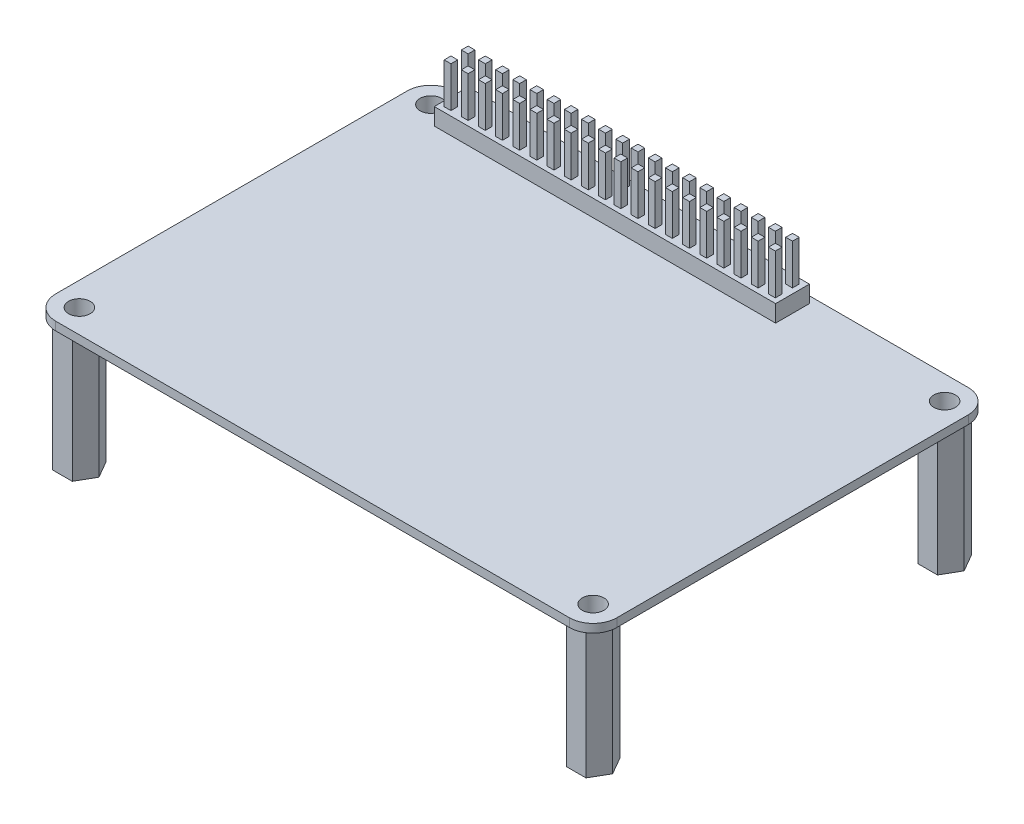
from build123d import *
from build123d.topology import SkipClean

# Parameters (mm, degrees)
ESQUISSE1_R        = 1.6
BOSS_EXTRU_1_DEPTH = 1.25
BOSS_EXTRU_2_START = 19.05
ESQUISSE2_R        = 1.6
BOSS_EXTRU_2_DEPTH = 19.05
ESQUISSE4_W        = 50.5
ESQUISSE4_H        = 5
BOSS_EXTRU_3_DEPTH = 2.5
ESQUISSE5_W        = 1
ESQUISSE5_H        = 1
BOSS_EXTRU_4_DEPTH = 6


with BuildPart() as part:
    # Esquisse1 → Boss.-Extru.1 (new body)
    with BuildSketch(Plane(origin=(0, 0, 0), x_dir=(1, 0, 0), z_dir=(0, 1, 0))):
        with BuildLine():
            Line((-38, -29.5), (38, -29.5))
            ThreePointArc((38, -29.5), (40.474873734, -28.474873734), (41.5, -26))
            Line((41.5, -26), (41.5, 26))
            ThreePointArc((41.5, 26), (40.474873734, 28.474873734), (38, 29.5))
            Line((38, 29.5), (-38, 29.5))
            ThreePointArc((-38, 29.5), (-40.474873734, 28.474873734), (-41.5, 26))
            Line((-41.5, 26), (-41.5, -26))
            ThreePointArc((-41.5, -26), (-40.474873734, -28.474873734), (-38, -29.5))
        make_face()
        with Locations(Location((38, 26, 0), (0, 0, 270))):
            Circle(ESQUISSE1_R, mode=Mode.SUBTRACT)
        with Locations(Location((38, -26, 0), (0, 0, 270))):
            Circle(ESQUISSE1_R, mode=Mode.SUBTRACT)
        with Locations(Location((-38, 26, 0), (0, 0, 270))):
            Circle(ESQUISSE1_R, mode=Mode.SUBTRACT)
        with Locations(Location((-38, -26, 0), (0, 0, 270))):
            Circle(ESQUISSE1_R, mode=Mode.SUBTRACT)
    extrude(amount=BOSS_EXTRU_1_DEPTH)

    # Esquisse2 → Boss.-Extru.2 (add)
    # profile 1 of 4: a face of its own
    with SkipClean():  # the faces are left unmerged after this step: merging them gives an invalid solid
        with BuildSketch(Plane.XZ.offset(BOSS_EXTRU_2_START)):
            Polygon((-36.556624327, 28.5), (-39.443375673, 28.5), (-40.886751346, 26), (-39.443375673, 23.5), (-36.556624327, 23.5), (-35.113248654, 26), align=None)
            with Locations(Location((-38, 26, 0), (0, 0, 270))):
                Circle(ESQUISSE2_R, mode=Mode.SUBTRACT)
        # profile 2 of 4: a face of its own
        with BuildSketch(Plane.XZ.offset(BOSS_EXTRU_2_START)):
            Polygon((-36.556624327, -23.5), (-39.443375673, -23.5), (-40.886751346, -26), (-39.443375673, -28.5), (-36.556624327, -28.5), (-35.113248654, -26), align=None)
            with Locations(Location((-38, -26, 0), (0, 0, 270))):
                Circle(ESQUISSE2_R, mode=Mode.SUBTRACT)
        # profile 3 of 4: a face of its own
        with BuildSketch(Plane.XZ.offset(BOSS_EXTRU_2_START)):
            Polygon((39.443375673, -23.5), (36.556624327, -23.5), (35.113248654, -26), (36.556624327, -28.5), (39.443375673, -28.5), (40.886751346, -26), align=None)
            with Locations(Location((38, -26, 0), (0, 0, 270))):
                Circle(ESQUISSE2_R, mode=Mode.SUBTRACT)
        # profile 4 of 4: a face of its own
        with BuildSketch(Plane.XZ.offset(BOSS_EXTRU_2_START)):
            Polygon((36.556624327, 23.5), (39.443375673, 23.5), (40.886751346, 26), (39.443375673, 28.5), (36.556624327, 28.5), (35.113248654, 26), align=None)
            with Locations(Location((38, 26, 0), (0, 0, 270))):
                Circle(ESQUISSE2_R, mode=Mode.SUBTRACT)
        extrude(amount=-BOSS_EXTRU_2_DEPTH)

    # Esquisse4 → Boss.-Extru.3 (add)
    with SkipClean():  # the faces are left unmerged after this step: merging them gives an invalid solid
        with BuildSketch(Plane(origin=(0, 1.25, 0), x_dir=(1, 0, 0), z_dir=(0, 1, 0))):
            with Locations((-9.75, 26)):
                Rectangle(ESQUISSE4_W, ESQUISSE4_H)
        extrude(amount=BOSS_EXTRU_3_DEPTH)

    # Esquisse5 → Boss.-Extru.4 (add)
    with SkipClean():  # the faces are left unmerged after this step: merging them gives an invalid solid
        with BuildSketch(Plane(origin=(0, 3.75, 0), x_dir=(1, 0, 0), z_dir=(0, 1, 0))):
            with Locations((14.245, 27.25)):
                Rectangle(ESQUISSE5_W, ESQUISSE5_H)
            with Locations((-10.885, 27.25)):
                Rectangle(ESQUISSE5_W, ESQUISSE5_H)
            with Locations((-13.425, 27.25)):
                Rectangle(ESQUISSE5_W, ESQUISSE5_H)
            with Locations((-15.965, 27.25)):
                Rectangle(ESQUISSE5_W, ESQUISSE5_H)
            with Locations((-18.505, 27.25)):
                Rectangle(ESQUISSE5_W, ESQUISSE5_H)
            with Locations((-21.045, 27.25)):
                Rectangle(ESQUISSE5_W, ESQUISSE5_H)
            with Locations((-23.585, 27.25)):
                Rectangle(ESQUISSE5_W, ESQUISSE5_H)
            with Locations((-26.125, 27.25)):
                Rectangle(ESQUISSE5_W, ESQUISSE5_H)
            with Locations((-28.665, 27.25)):
                Rectangle(ESQUISSE5_W, ESQUISSE5_H)
            with Locations((-31.205, 27.25)):
                Rectangle(ESQUISSE5_W, ESQUISSE5_H)
            with Locations((-33.745, 27.25)):
                Rectangle(ESQUISSE5_W, ESQUISSE5_H)
            with Locations((11.705, 27.25)):
                Rectangle(ESQUISSE5_W, ESQUISSE5_H)
            with Locations((9.165, 27.25)):
                Rectangle(ESQUISSE5_W, ESQUISSE5_H)
            with Locations((6.625, 27.25)):
                Rectangle(ESQUISSE5_W, ESQUISSE5_H)
            with Locations((4.085, 27.25)):
                Rectangle(ESQUISSE5_W, ESQUISSE5_H)
            with Locations((1.545, 27.25)):
                Rectangle(ESQUISSE5_W, ESQUISSE5_H)
            with Locations((-0.995, 27.25)):
                Rectangle(ESQUISSE5_W, ESQUISSE5_H)
            with Locations((-3.535, 27.25)):
                Rectangle(ESQUISSE5_W, ESQUISSE5_H)
            with Locations((-6.075, 27.25)):
                Rectangle(ESQUISSE5_W, ESQUISSE5_H)
            with Locations((-8.615, 27.25)):
                Rectangle(ESQUISSE5_W, ESQUISSE5_H)
            with Locations((14.245, 24.71)):
                Rectangle(ESQUISSE5_W, ESQUISSE5_H)
            with Locations((-10.885, 24.71)):
                Rectangle(ESQUISSE5_W, ESQUISSE5_H)
            with Locations((-13.425, 24.71)):
                Rectangle(ESQUISSE5_W, ESQUISSE5_H)
            with Locations((-15.965, 24.71)):
                Rectangle(ESQUISSE5_W, ESQUISSE5_H)
            with Locations((-18.505, 24.71)):
                Rectangle(ESQUISSE5_W, ESQUISSE5_H)
            with Locations((-21.045, 24.71)):
                Rectangle(ESQUISSE5_W, ESQUISSE5_H)
            with Locations((-23.585, 24.71)):
                Rectangle(ESQUISSE5_W, ESQUISSE5_H)
            with Locations((-26.125, 24.71)):
                Rectangle(ESQUISSE5_W, ESQUISSE5_H)
            with Locations((-28.665, 24.71)):
                Rectangle(ESQUISSE5_W, ESQUISSE5_H)
            with Locations((-31.205, 24.71)):
                Rectangle(ESQUISSE5_W, ESQUISSE5_H)
            with Locations((-33.745, 24.71)):
                Rectangle(ESQUISSE5_W, ESQUISSE5_H)
            with Locations((11.705, 24.71)):
                Rectangle(ESQUISSE5_W, ESQUISSE5_H)
            with Locations((9.165, 24.71)):
                Rectangle(ESQUISSE5_W, ESQUISSE5_H)
            with Locations((6.625, 24.71)):
                Rectangle(ESQUISSE5_W, ESQUISSE5_H)
            with Locations((4.085, 24.71)):
                Rectangle(ESQUISSE5_W, ESQUISSE5_H)
            with Locations((1.545, 24.71)):
                Rectangle(ESQUISSE5_W, ESQUISSE5_H)
            with Locations((-0.995, 24.71)):
                Rectangle(ESQUISSE5_W, ESQUISSE5_H)
            with Locations((-3.535, 24.71)):
                Rectangle(ESQUISSE5_W, ESQUISSE5_H)
            with Locations((-6.075, 24.71)):
                Rectangle(ESQUISSE5_W, ESQUISSE5_H)
            with Locations((-8.615, 24.71)):
                Rectangle(ESQUISSE5_W, ESQUISSE5_H)
        extrude(amount=BOSS_EXTRU_4_DEPTH)


solid = part.part
